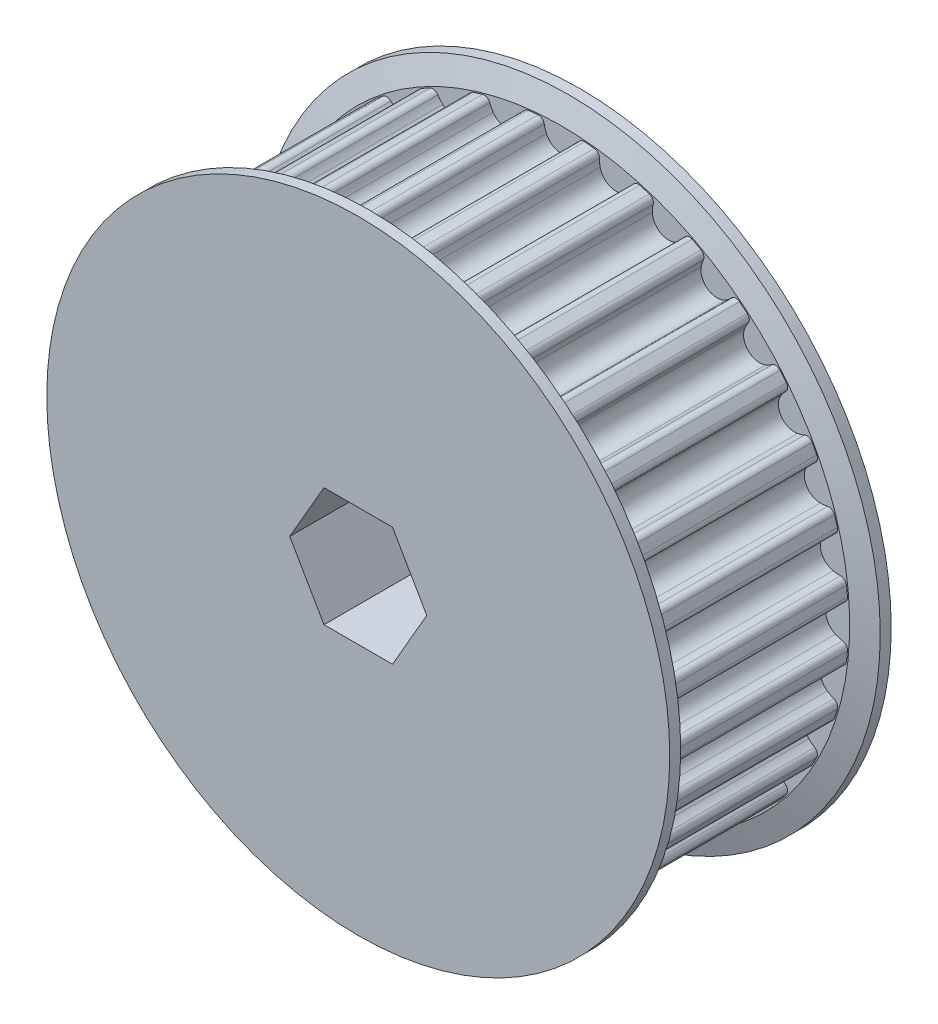
from build123d import *

# Parameters (mm, degrees)
BOSS_EXTRUDE1_DEPTH = 16
SKETCH2_R           = 27
BOSS_EXTRUDE2_DEPTH = 1.6
BOSS_EXTRUDE3_START = -1.6
SKETCH3_R           = 27
BOSS_EXTRUDE3_DEPTH = 1.6
CHAMFER1_SIZE       = 2
CHAMFER1_SIZE2      = 0.649839392
CHAMFER2_SIZE       = 2
CHAMFER2_SIZE2      = 0.649839392
CUT_EXTRUDE6_DEPTH  = 43.739209164


with BuildPart() as part:
    # Sketch1 → Boss-Extrude1 (new body)
    with BuildSketch(Plane.XY.offset(-1.6)):
        with BuildLine():
            ThreePointArc((23.690688302, -7.633045773), (23.818244956, -7.225185617), (23.938780436, -6.815195611))
            ThreePointArc((23.938780436, -6.815195611), (23.90418297, -6.448154525), (23.630480696, -6.201166249))
            ThreePointArc((23.630480696, -6.201166249), (23.335534255, -6.068193037), (23.058878873, -5.900451932))
            ThreePointArc((23.058878873, -5.900451932), (22.481069805, -4.471762816), (23.561631432, -3.372944141))
            ThreePointArc((23.561631432, -3.372944141), (23.881419418, -3.323842999), (24.204801043, -3.313862886))
            ThreePointArc((24.204801043, -3.313862886), (24.552187293, -3.190416798), (24.724611727, -2.864554929))
            ThreePointArc((24.724611727, -2.864554929), (24.770147847, -2.439646623), (24.808382189, -2.014019154))
            ThreePointArc((24.808382189, -2.014019154), (24.702843339, -1.660780291), (24.386215156, -1.47193449))
            ThreePointArc((24.386215156, -1.47193449), (24.070994241, -1.399057517), (23.766930049, -1.288512298))
            ThreePointArc((23.766930049, -1.288512298), (22.9215, 0), (23.766930049, 1.288512298))
            ThreePointArc((23.766930049, 1.288512298), (24.070994241, 1.399057517), (24.386215156, 1.47193449))
            ThreePointArc((24.386215156, 1.47193449), (24.702843339, 1.660780291), (24.808382189, 2.014019154))
            ThreePointArc((24.808382189, 2.014019154), (24.770147847, 2.439646623), (24.724611727, 2.864554929))
            ThreePointArc((24.724611727, 2.864554929), (24.552187293, 3.190416798), (24.204801043, 3.313862886))
            ThreePointArc((24.204801043, 3.313862886), (23.881419418, 3.323842999), (23.561631432, 3.372944141))
            ThreePointArc((23.561631432, 3.372944141), (22.481069805, 4.471762816), (23.058878873, 5.900451932))
            ThreePointArc((23.058878873, 5.900451932), (23.335534255, 6.068193037), (23.630480696, 6.201166249))
            ThreePointArc((23.630480696, 6.201166249), (23.90418297, 6.448154525), (23.938780436, 6.815195611))
            ThreePointArc((23.938780436, 6.815195611), (23.818244956, 7.225185617), (23.690688302, 7.633045773))
            ThreePointArc((23.690688302, 7.633045773), (23.458004458, 7.919007959), (23.093210001, 7.97231037))
            ThreePointArc((23.093210001, 7.97231037), (22.774095039, 7.919010092), (22.450872532, 7.904780228))
            ThreePointArc((22.450872532, 7.904780228), (21.176704704, 8.771678295), (21.464687914, 10.285640508))
            ThreePointArc((21.464687914, 10.285640508), (21.703302774, 10.504131301), (21.966640115, 10.692090666))
            ThreePointArc((21.966640115, 10.692090666), (22.186898254, 10.987729797), (22.149224776, 11.354467922))
            ThreePointArc((22.149224776, 11.354467922), (21.95102027, 11.73306478), (21.746345012, 12.108202948))
            ThreePointArc((21.746345012, 12.108202948), (21.462343667, 12.343276086), (21.094159849, 12.324386437))
            ThreePointArc((21.094159849, 12.324386437), (20.79157496, 12.209854068), (20.477339191, 12.132840044))
            ThreePointArc((20.477339191, 12.132840044), (19.058530718, 12.734503096), (19.045621036, 14.275557687))
            ThreePointArc((19.045621036, 14.275557687), (19.237025539, 14.536401691), (19.458633874, 14.772124036))
            ThreePointArc((19.458633874, 14.772124036), (19.616983481, 15.105052775), (19.50848683, 15.457394399))
            ThreePointArc((19.50848683, 15.457394399), (19.240230184, 15.790048843), (18.966301878, 16.118048675))
            ThreePointArc((18.966301878, 16.118048675), (18.641897046, 16.293199034), (18.284472963, 16.202843245))
            ThreePointArc((18.284472963, 16.202843245), (18.010046315, 16.0314802), (17.716873189, 15.894641622))
            ThreePointArc((17.716873189, 15.894641622), (16.207948085, 16.207948085), (15.894641622, 17.716873189))
            ThreePointArc((15.894641622, 17.716873189), (16.0314802, 18.010046315), (16.202843245, 18.284472963))
            ThreePointArc((16.202843245, 18.284472963), (16.293199034, 18.641897046), (16.118048675, 18.966301878))
            ThreePointArc((16.118048675, 18.966301878), (15.790048843, 19.240230184), (15.457394399, 19.50848683))
            ThreePointArc((15.457394399, 19.50848683), (15.105052775, 19.616983481), (14.772124036, 19.458633874))
            ThreePointArc((14.772124036, 19.458633874), (14.536401691, 19.237025539), (14.275557687, 19.045621036))
            ThreePointArc((14.275557687, 19.045621036), (12.734503096, 19.058530718), (12.132840044, 20.477339191))
            ThreePointArc((12.132840044, 20.477339191), (12.209854068, 20.79157496), (12.324386437, 21.094159849))
            ThreePointArc((12.324386437, 21.094159849), (12.343276086, 21.462343667), (12.108202948, 21.746345012))
            ThreePointArc((12.108202948, 21.746345012), (11.73306478, 21.95102027), (11.354467922, 22.149224777))
            ThreePointArc((11.354467922, 22.149224777), (10.987729797, 22.186898254), (10.692090666, 21.966640115))
            ThreePointArc((10.692090666, 21.966640115), (10.504131301, 21.703302774), (10.285640508, 21.464687914))
            ThreePointArc((10.285640508, 21.464687914), (8.771678295, 21.176704704), (7.904780228, 22.450872532))
            ThreePointArc((7.904780228, 22.450872532), (7.919010092, 22.774095039), (7.97231037, 23.093210001))
            ThreePointArc((7.97231037, 23.093210001), (7.919007959, 23.458004458), (7.633045773, 23.690688302))
            ThreePointArc((7.633045773, 23.690688302), (7.225185617, 23.818244956), (6.815195611, 23.938780436))
            ThreePointArc((6.815195611, 23.938780436), (6.448154525, 23.90418297), (6.201166249, 23.630480696))
            ThreePointArc((6.201166249, 23.630480696), (6.068193037, 23.335534255), (5.900451932, 23.058878873))
            ThreePointArc((5.900451932, 23.058878873), (4.471762816, 22.481069805), (3.372944141, 23.561631432))
            ThreePointArc((3.372944141, 23.561631432), (3.323842999, 23.881419418), (3.313862886, 24.204801043))
            ThreePointArc((3.313862886, 24.204801043), (3.190416798, 24.552187293), (2.864554929, 24.724611727))
            ThreePointArc((2.864554929, 24.724611727), (2.439646623, 24.770147847), (2.014019154, 24.808382189))
            ThreePointArc((2.014019154, 24.808382189), (1.660780291, 24.702843339), (1.47193449, 24.386215156))
            ThreePointArc((1.47193449, 24.386215156), (1.399057517, 24.070994241), (1.288512298, 23.766930049))
            ThreePointArc((1.288512298, 23.766930049), (0, 22.9215), (-1.288512298, 23.766930049))
            ThreePointArc((-1.288512298, 23.766930049), (-1.399057517, 24.070994241), (-1.47193449, 24.386215156))
            ThreePointArc((-1.47193449, 24.386215156), (-1.660780291, 24.702843339), (-2.014019154, 24.808382189))
            ThreePointArc((-2.014019154, 24.808382189), (-2.439646623, 24.770147847), (-2.864554929, 24.724611727))
            ThreePointArc((-2.864554929, 24.724611727), (-3.190416798, 24.552187293), (-3.313862886, 24.204801043))
            ThreePointArc((-3.313862886, 24.204801043), (-3.323842999, 23.881419418), (-3.372944141, 23.561631432))
            ThreePointArc((-3.372944141, 23.561631432), (-4.471762816, 22.481069805), (-5.900451932, 23.058878873))
            ThreePointArc((-5.900451932, 23.058878873), (-6.068193037, 23.335534255), (-6.201166249, 23.630480696))
            ThreePointArc((-6.201166249, 23.630480696), (-6.448154525, 23.90418297), (-6.815195611, 23.938780436))
            ThreePointArc((-6.815195611, 23.938780436), (-7.225185617, 23.818244956), (-7.633045773, 23.690688302))
            ThreePointArc((-7.633045773, 23.690688302), (-7.919007959, 23.458004458), (-7.97231037, 23.093210001))
            ThreePointArc((-7.97231037, 23.093210001), (-7.919010092, 22.774095039), (-7.904780228, 22.450872532))
            ThreePointArc((-7.904780228, 22.450872532), (-8.771678295, 21.176704704), (-10.285640508, 21.464687914))
            ThreePointArc((-10.285640508, 21.464687914), (-10.504131301, 21.703302774), (-10.692090666, 21.966640115))
            ThreePointArc((-10.692090666, 21.966640115), (-10.987729797, 22.186898254), (-11.354467922, 22.149224777))
            ThreePointArc((-11.354467922, 22.149224777), (-11.73306478, 21.95102027), (-12.108202948, 21.746345012))
            ThreePointArc((-12.108202948, 21.746345012), (-12.343276086, 21.462343667), (-12.324386437, 21.094159849))
            ThreePointArc((-12.324386437, 21.094159849), (-12.209854068, 20.79157496), (-12.132840044, 20.477339191))
            ThreePointArc((-12.132840044, 20.477339191), (-12.734503096, 19.058530718), (-14.275557687, 19.045621036))
            ThreePointArc((-14.275557687, 19.045621036), (-14.536401691, 19.237025539), (-14.772124036, 19.458633874))
            ThreePointArc((-14.772124036, 19.458633874), (-15.105052775, 19.616983481), (-15.457394399, 19.50848683))
            ThreePointArc((-15.457394399, 19.50848683), (-15.790048843, 19.240230184), (-16.118048675, 18.966301878))
            ThreePointArc((-16.118048675, 18.966301878), (-16.293199034, 18.641897046), (-16.202843245, 18.284472963))
            ThreePointArc((-16.202843245, 18.284472963), (-16.0314802, 18.010046315), (-15.894641622, 17.716873189))
            ThreePointArc((-15.894641622, 17.716873189), (-16.207948085, 16.207948085), (-17.716873189, 15.894641622))
            ThreePointArc((-17.716873189, 15.894641622), (-18.010046315, 16.0314802), (-18.284472963, 16.202843245))
            ThreePointArc((-18.284472963, 16.202843245), (-18.641897046, 16.293199034), (-18.966301878, 16.118048675))
            ThreePointArc((-18.966301878, 16.118048675), (-19.240230184, 15.790048843), (-19.50848683, 15.457394399))
            ThreePointArc((-19.50848683, 15.457394399), (-19.616983481, 15.105052775), (-19.458633874, 14.772124036))
            ThreePointArc((-19.458633874, 14.772124036), (-19.237025539, 14.536401691), (-19.045621036, 14.275557687))
            ThreePointArc((-19.045621036, 14.275557687), (-19.058530718, 12.734503096), (-20.477339191, 12.132840044))
            ThreePointArc((-20.477339191, 12.132840044), (-20.79157496, 12.209854068), (-21.094159849, 12.324386437))
            ThreePointArc((-21.094159849, 12.324386437), (-21.462343667, 12.343276086), (-21.746345012, 12.108202948))
            ThreePointArc((-21.746345012, 12.108202948), (-21.95102027, 11.73306478), (-22.149224776, 11.354467922))
            ThreePointArc((-22.149224776, 11.354467922), (-22.186898254, 10.987729797), (-21.966640115, 10.692090666))
            ThreePointArc((-21.966640115, 10.692090666), (-21.703302774, 10.504131301), (-21.464687914, 10.285640508))
            ThreePointArc((-21.464687914, 10.285640508), (-21.176704704, 8.771678295), (-22.450872532, 7.904780228))
            ThreePointArc((-22.450872532, 7.904780228), (-22.774095039, 7.919010092), (-23.093210001, 7.97231037))
            ThreePointArc((-23.093210001, 7.97231037), (-23.458004458, 7.919007959), (-23.690688302, 7.633045773))
            ThreePointArc((-23.690688302, 7.633045773), (-23.818244956, 7.225185617), (-23.938780436, 6.815195611))
            ThreePointArc((-23.938780436, 6.815195611), (-23.90418297, 6.448154525), (-23.630480696, 6.201166249))
            ThreePointArc((-23.630480696, 6.201166249), (-23.335534255, 6.068193037), (-23.058878873, 5.900451932))
            ThreePointArc((-23.058878873, 5.900451932), (-22.481069805, 4.471762816), (-23.561631432, 3.372944141))
            ThreePointArc((-23.561631432, 3.372944141), (-23.881419418, 3.323842999), (-24.204801043, 3.313862886))
            ThreePointArc((-24.204801043, 3.313862886), (-24.552187293, 3.190416798), (-24.724611727, 2.864554929))
            ThreePointArc((-24.724611727, 2.864554929), (-24.770147847, 2.439646623), (-24.808382189, 2.014019154))
            ThreePointArc((-24.808382189, 2.014019154), (-24.702843339, 1.660780291), (-24.386215156, 1.47193449))
            ThreePointArc((-24.386215156, 1.47193449), (-24.070994241, 1.399057517), (-23.766930049, 1.288512298))
            ThreePointArc((-23.766930049, 1.288512298), (-22.9215, 0), (-23.766930049, -1.288512298))
            ThreePointArc((-23.766930049, -1.288512298), (-24.070994241, -1.399057517), (-24.386215156, -1.47193449))
            ThreePointArc((-24.386215156, -1.47193449), (-24.702843339, -1.660780291), (-24.808382189, -2.014019154))
            ThreePointArc((-24.808382189, -2.014019154), (-24.770147847, -2.439646623), (-24.724611727, -2.864554929))
            ThreePointArc((-24.724611727, -2.864554929), (-24.552187293, -3.190416798), (-24.204801043, -3.313862886))
            ThreePointArc((-24.204801043, -3.313862886), (-23.881419418, -3.323842999), (-23.561631432, -3.372944141))
            ThreePointArc((-23.561631432, -3.372944141), (-22.481069805, -4.471762816), (-23.058878873, -5.900451932))
            ThreePointArc((-23.058878873, -5.900451932), (-23.335534255, -6.068193037), (-23.630480696, -6.201166249))
            ThreePointArc((-23.630480696, -6.201166249), (-23.90418297, -6.448154525), (-23.938780436, -6.815195611))
            ThreePointArc((-23.938780436, -6.815195611), (-23.818244956, -7.225185617), (-23.690688302, -7.633045773))
            ThreePointArc((-23.690688302, -7.633045773), (-23.458004458, -7.919007959), (-23.093210001, -7.97231037))
            ThreePointArc((-23.093210001, -7.97231037), (-22.774095039, -7.919010092), (-22.450872532, -7.904780228))
            ThreePointArc((-22.450872532, -7.904780228), (-21.176704704, -8.771678295), (-21.464687914, -10.285640508))
            ThreePointArc((-21.464687914, -10.285640508), (-21.703302774, -10.504131301), (-21.966640115, -10.692090666))
            ThreePointArc((-21.966640115, -10.692090666), (-22.186898254, -10.987729797), (-22.149224776, -11.354467922))
            ThreePointArc((-22.149224776, -11.354467922), (-21.95102027, -11.73306478), (-21.746345012, -12.108202948))
            ThreePointArc((-21.746345012, -12.108202948), (-21.462343667, -12.343276086), (-21.094159849, -12.324386437))
            ThreePointArc((-21.094159849, -12.324386437), (-20.79157496, -12.209854068), (-20.477339191, -12.132840044))
            ThreePointArc((-20.477339191, -12.132840044), (-19.058530718, -12.734503096), (-19.045621036, -14.275557687))
            ThreePointArc((-19.045621036, -14.275557687), (-19.237025539, -14.536401691), (-19.458633874, -14.772124036))
            ThreePointArc((-19.458633874, -14.772124036), (-19.616983481, -15.105052775), (-19.50848683, -15.457394399))
            ThreePointArc((-19.50848683, -15.457394399), (-19.240230184, -15.790048843), (-18.966301878, -16.118048675))
            ThreePointArc((-18.966301878, -16.118048675), (-18.641897046, -16.293199034), (-18.284472963, -16.202843245))
            ThreePointArc((-18.284472963, -16.202843245), (-18.010046315, -16.0314802), (-17.716873189, -15.894641622))
            ThreePointArc((-17.716873189, -15.894641622), (-16.207948085, -16.207948085), (-15.894641622, -17.716873189))
            ThreePointArc((-15.894641622, -17.716873189), (-16.0314802, -18.010046315), (-16.202843245, -18.284472963))
            ThreePointArc((-16.202843245, -18.284472963), (-16.293199034, -18.641897046), (-16.118048675, -18.966301878))
            ThreePointArc((-16.118048675, -18.966301878), (-15.790048843, -19.240230184), (-15.457394399, -19.50848683))
            ThreePointArc((-15.457394399, -19.50848683), (-15.105052775, -19.616983481), (-14.772124036, -19.458633874))
            ThreePointArc((-14.772124036, -19.458633874), (-14.536401691, -19.237025539), (-14.275557687, -19.045621036))
            ThreePointArc((-14.275557687, -19.045621036), (-12.734503096, -19.058530718), (-12.132840044, -20.477339191))
            ThreePointArc((-12.132840044, -20.477339191), (-12.209854068, -20.79157496), (-12.324386437, -21.094159849))
            ThreePointArc((-12.324386437, -21.094159849), (-12.343276086, -21.462343667), (-12.108202948, -21.746345012))
            ThreePointArc((-12.108202948, -21.746345012), (-11.73306478, -21.95102027), (-11.354467922, -22.149224776))
            ThreePointArc((-11.354467922, -22.149224776), (-10.987729797, -22.186898254), (-10.692090666, -21.966640115))
            ThreePointArc((-10.692090666, -21.966640115), (-10.504131301, -21.703302774), (-10.285640508, -21.464687914))
            ThreePointArc((-10.285640508, -21.464687914), (-8.771678295, -21.176704704), (-7.904780228, -22.450872532))
            ThreePointArc((-7.904780228, -22.450872532), (-7.919010092, -22.774095039), (-7.97231037, -23.093210001))
            ThreePointArc((-7.97231037, -23.093210001), (-7.919007959, -23.458004458), (-7.633045773, -23.690688302))
            ThreePointArc((-7.633045773, -23.690688302), (-7.225185617, -23.818244956), (-6.815195611, -23.938780436))
            ThreePointArc((-6.815195611, -23.938780436), (-6.448154525, -23.90418297), (-6.201166249, -23.630480696))
            ThreePointArc((-6.201166249, -23.630480696), (-6.068193037, -23.335534255), (-5.900451932, -23.058878873))
            ThreePointArc((-5.900451932, -23.058878873), (-4.471762816, -22.481069805), (-3.372944141, -23.561631432))
            ThreePointArc((-3.372944141, -23.561631432), (-3.323842999, -23.881419418), (-3.313862886, -24.204801043))
            ThreePointArc((-3.313862886, -24.204801043), (-3.190416798, -24.552187293), (-2.864554929, -24.724611727))
            ThreePointArc((-2.864554929, -24.724611727), (-2.439646623, -24.770147847), (-2.014019154, -24.808382189))
            ThreePointArc((-2.014019154, -24.808382189), (-1.660780291, -24.702843339), (-1.47193449, -24.386215156))
            ThreePointArc((-1.47193449, -24.386215156), (-1.399057517, -24.070994241), (-1.288512298, -23.766930049))
            ThreePointArc((-1.288512298, -23.766930049), (0, -22.9215), (1.288512298, -23.766930049))
            ThreePointArc((1.288512298, -23.766930049), (1.399057517, -24.070994241), (1.47193449, -24.386215156))
            ThreePointArc((1.47193449, -24.386215156), (1.660780291, -24.702843339), (2.014019154, -24.808382189))
            ThreePointArc((2.014019154, -24.808382189), (2.439646623, -24.770147847), (2.864554929, -24.724611727))
            ThreePointArc((2.864554929, -24.724611727), (3.190416798, -24.552187293), (3.313862886, -24.204801043))
            ThreePointArc((3.313862886, -24.204801043), (3.323842999, -23.881419418), (3.372944141, -23.561631432))
            ThreePointArc((3.372944141, -23.561631432), (4.471762816, -22.481069805), (5.900451932, -23.058878873))
            ThreePointArc((5.900451932, -23.058878873), (6.068193037, -23.335534255), (6.201166249, -23.630480696))
            ThreePointArc((6.201166249, -23.630480696), (6.448154525, -23.90418297), (6.815195611, -23.938780436))
            ThreePointArc((6.815195611, -23.938780436), (7.225185617, -23.818244956), (7.633045773, -23.690688302))
            ThreePointArc((7.633045773, -23.690688302), (7.919007959, -23.458004458), (7.97231037, -23.093210001))
            ThreePointArc((7.97231037, -23.093210001), (7.919010092, -22.774095039), (7.904780228, -22.450872532))
            ThreePointArc((7.904780228, -22.450872532), (8.771678295, -21.176704704), (10.285640508, -21.464687914))
            ThreePointArc((10.285640508, -21.464687914), (10.504131301, -21.703302774), (10.692090666, -21.966640115))
            ThreePointArc((10.692090666, -21.966640115), (10.987729797, -22.186898254), (11.354467922, -22.149224776))
            ThreePointArc((11.354467922, -22.149224776), (11.73306478, -21.95102027), (12.108202948, -21.746345012))
            ThreePointArc((12.108202948, -21.746345012), (12.343276086, -21.462343667), (12.324386437, -21.094159849))
            ThreePointArc((12.324386437, -21.094159849), (12.209854068, -20.79157496), (12.132840044, -20.477339191))
            ThreePointArc((12.132840044, -20.477339191), (12.734503096, -19.058530718), (14.275557687, -19.045621036))
            ThreePointArc((14.275557687, -19.045621036), (14.536401691, -19.237025539), (14.772124036, -19.458633874))
            ThreePointArc((14.772124036, -19.458633874), (15.105052775, -19.616983481), (15.457394399, -19.50848683))
            ThreePointArc((15.457394399, -19.50848683), (15.790048843, -19.240230184), (16.118048675, -18.966301878))
            ThreePointArc((16.118048675, -18.966301878), (16.293199034, -18.641897046), (16.202843245, -18.284472963))
            ThreePointArc((16.202843245, -18.284472963), (16.0314802, -18.010046315), (15.894641622, -17.716873189))
            ThreePointArc((15.894641622, -17.716873189), (16.207948085, -16.207948085), (17.716873189, -15.894641622))
            ThreePointArc((17.716873189, -15.894641622), (18.010046315, -16.0314802), (18.284472963, -16.202843245))
            ThreePointArc((18.284472963, -16.202843245), (18.641897046, -16.293199034), (18.966301878, -16.118048675))
            ThreePointArc((18.966301878, -16.118048675), (19.240230184, -15.790048843), (19.50848683, -15.457394399))
            ThreePointArc((19.50848683, -15.457394399), (19.616983481, -15.105052775), (19.458633874, -14.772124036))
            ThreePointArc((19.458633874, -14.772124036), (19.237025539, -14.536401691), (19.045621036, -14.275557687))
            ThreePointArc((19.045621036, -14.275557687), (19.058530718, -12.734503096), (20.477339191, -12.132840044))
            ThreePointArc((20.477339191, -12.132840044), (20.79157496, -12.209854068), (21.094159849, -12.324386437))
            ThreePointArc((21.094159849, -12.324386437), (21.462343667, -12.343276086), (21.746345012, -12.108202948))
            ThreePointArc((21.746345012, -12.108202948), (21.95102027, -11.73306478), (22.149224776, -11.354467922))
            ThreePointArc((22.149224776, -11.354467922), (22.186898254, -10.987729797), (21.966640115, -10.692090666))
            ThreePointArc((21.966640115, -10.692090666), (21.703302774, -10.504131301), (21.464687914, -10.285640508))
            ThreePointArc((21.464687914, -10.285640508), (21.176704704, -8.771678295), (22.450872532, -7.904780228))
            ThreePointArc((22.450872532, -7.904780228), (22.774095039, -7.919010092), (23.093210001, -7.97231037))
            ThreePointArc((23.093210001, -7.97231037), (23.458004458, -7.919007959), (23.690688302, -7.633045773))
        make_face()
    extrude(amount=-BOSS_EXTRUDE1_DEPTH)

    # Sketch2 → Boss-Extrude2 (add)
    with BuildSketch(Plane.XY.offset(-17.6)):
        Circle(SKETCH2_R)
    extrude(amount=-BOSS_EXTRUDE2_DEPTH)

    # Sketch3 → Boss-Extrude3 (add)
    with BuildSketch(Plane(origin=(0, 0, -1.6), x_dir=(-1, 0, 0), z_dir=(0, 0, -1)).offset(BOSS_EXTRUDE3_START)):
        with Locations(Location((0, 0, 0), (0, 0, 180))):
            Circle(SKETCH3_R)
    extrude(amount=BOSS_EXTRUDE3_DEPTH)

    # Chamfer1
    chamfer1_edges = [part.edges().sort_by_distance(p)[0] for p in [
        (-27, 0, -1.6),
    ]]
    chamfer1_side = [part.faces().sort_by_distance(p)[0] for p in [
        (-26.236324676, 0, -1.6),
    ]]
    chamfer(chamfer1_edges, length=CHAMFER1_SIZE, length2=CHAMFER1_SIZE2, reference=chamfer1_side[0])

    # Chamfer2
    chamfer2_edges = [part.edges().sort_by_distance(p)[0] for p in [
        (-27, 0, -17.6),
    ]]
    chamfer2_side = [part.faces().sort_by_distance(p)[0] for p in [
        (-26.236324676, 0, -17.6),
    ]]
    chamfer(chamfer2_edges, length=CHAMFER2_SIZE, length2=CHAMFER2_SIZE2, reference=chamfer2_side[0])

    # Sketch12 → Cut-Extrude6 (cut, through all)
    with BuildSketch(Plane(origin=(0, 0, -19.2), x_dir=(-1, 0, 0), z_dir=(0, 0, -1))):
        Polygon((2.96960111, -5.1435), (5.939202219, 0), (2.96960111, 5.1435), (-2.96960111, 5.1435), (-5.939202219, 0), (-2.96960111, -5.1435), align=None)
    extrude(amount=-CUT_EXTRUDE6_DEPTH, mode=Mode.SUBTRACT)


solid = part.part
